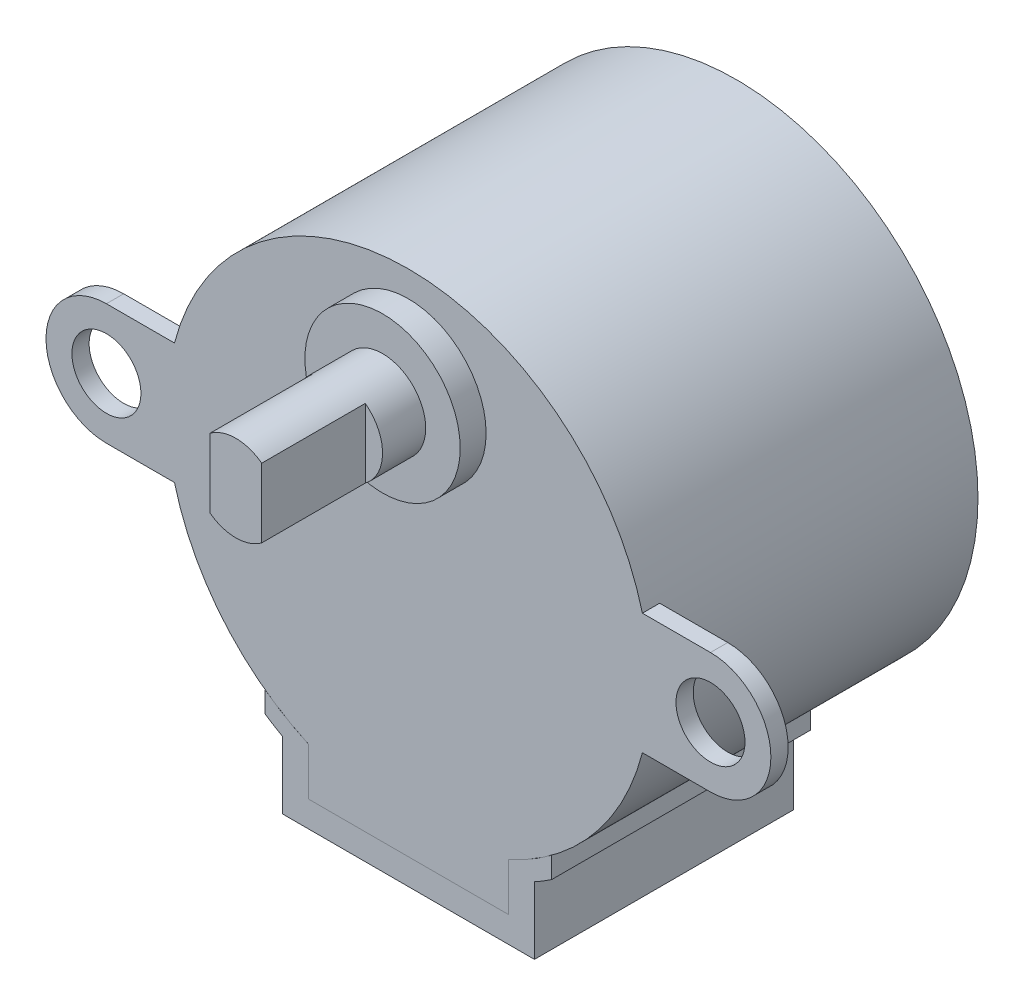
from build123d import *

# Parameters (mm, degrees)
SKETCH1_R           = 14
BOSS_EXTRUDE1_DEPTH = 19
SKETCH2_R           = 2
BOSS_EXTRUDE2_DEPTH = 1
SKETCH3_R           = 4.5
BOSS_EXTRUDE3_DEPTH = 1.5
SKETCH4_R           = 2.5
BOSS_EXTRUDE4_DEPTH = 8.5
CUT_EXTRUDE1_DEPTH  = 6
BOSS_EXTRUDE6_DEPTH = 15
BOSS_EXTRUDE7_DEPTH = 15
SKETCH10_W          = 6.5
SKETCH10_H          = 1.5
CUT_EXTRUDE2_DEPTH  = 1.5


with BuildPart() as part:
    # Sketch1 → Boss-Extrude1 (new body)
    with BuildSketch(Plane.XY):
        Circle(SKETCH1_R)
    extrude(amount=-BOSS_EXTRUDE1_DEPTH)

    # Sketch2 → Boss-Extrude2 (add)
    # profile 1 of 2: a face of its own
    with BuildSketch(Plane.XY):
        with BuildLine():
            Line((-13.555441712, 3.5), (-17.5, 3.5))
            ThreePointArc((-17.5, 3.5), (-21, 0), (-17.5, -3.5))
            Line((-17.5, -3.5), (-13.555441712, -3.5))
            ThreePointArc((-13.555441712, -3.5), (-14, 0), (-13.555441712, 3.5))
        make_face()
        with Locations((-17.5, 0)):
            Circle(SKETCH2_R, mode=Mode.SUBTRACT)
    # profile 2 of 2: a face of its own
    with BuildSketch(Plane.XY):
        with BuildLine():
            Line((17.5, 3.5), (13.555441712, 3.5))
            ThreePointArc((13.555441712, 3.5), (13.888415748, 1.764060095), (14, 0))
            ThreePointArc((14, 0), (13.888415748, -1.764060095), (13.555441712, -3.5))
            Line((13.555441712, -3.5), (17.5, -3.5))
            ThreePointArc((17.5, -3.5), (21, 0), (17.5, 3.5))
        make_face()
        with Locations((17.5, 0)):
            Circle(SKETCH2_R, mode=Mode.SUBTRACT)
    extrude(amount=-BOSS_EXTRUDE2_DEPTH)

    # Sketch3 → Boss-Extrude3 (add)
    with BuildSketch(Plane.XY):
        with Locations((0, 8)):
            Circle(SKETCH3_R)
    extrude(amount=BOSS_EXTRUDE3_DEPTH)

    # Sketch9 → Boss-Extrude7 (add)
    with BuildSketch(Plane.XY):
        with BuildLine():
            Line((5.8, -15.5), (5.8, -12.742056349))
            ThreePointArc((5.8, -12.742056349), (0, -14), (-5.8, -12.742056349))
            Line((-5.8, -12.742056349), (-5.8, -15.5))
            Line((-5.8, -15.5), (5.8, -15.5))
        make_face()
    extrude(amount=-BOSS_EXTRUDE7_DEPTH)


with BuildPart() as body_2:
    # Sketch4 → Boss-Extrude4 (new body)
    with BuildSketch(Plane.XY.offset(1.5)):
        with Locations((0, 8)):
            Circle(SKETCH4_R)
    extrude(amount=BOSS_EXTRUDE4_DEPTH)

    # Sketch5 → Cut-Extrude1 (cut)
    with BuildSketch(Plane.XY.offset(10)):
        with BuildLine():
            Line((-1.5, 6), (-1.5, 10))
            ThreePointArc((-1.5, 10), (-2.5, 8), (-1.5, 6))
        make_face()
        with BuildLine():
            ThreePointArc((2.5, 8), (2.236067977, 9.118033989), (1.5, 10))
            Line((1.5, 10), (1.5, 6))
            ThreePointArc((1.5, 6), (2.236067977, 6.881966011), (2.5, 8))
        make_face()
    extrude(amount=-CUT_EXTRUDE1_DEPTH, mode=Mode.SUBTRACT)


with BuildPart() as body_3:
    # Sketch6 → Boss-Extrude6 (new body)
    with BuildSketch(Plane.XY):
        with BuildLine():
            Line((-7.3, -13.103816238), (-7.3, -17))
            Line((-7.3, -17), (7.3, -17))
            Line((7.3, -17), (7.3, -13.103816238))
            ThreePointArc((7.3, -13.103816238), (7.805949489, -12.808870074), (8.3, -12.494398745))
            Line((8.3, -12.494398745), (8.3, -11.274307074))
            ThreePointArc((8.3, -11.274307074), (7.088093678, -12.073066223), (5.8, -12.742056349))
            Line((5.8, -12.742056349), (5.8, -15.5))
            Line((5.8, -15.5), (-5.8, -15.5))
            Line((-5.8, -15.5), (-5.8, -12.742056349))
            ThreePointArc((-5.8, -12.742056349), (-7.088093678, -12.073066223), (-8.3, -11.274307074))
            Line((-8.3, -11.274307074), (-8.3, -12.494398745))
            ThreePointArc((-8.3, -12.494398745), (-7.805949489, -12.808870074), (-7.3, -13.103816238))
        make_face()
    extrude(amount=-BOSS_EXTRUDE6_DEPTH)

    # Sketch10 → Cut-Extrude2 (cut)
    with BuildSketch(Plane(origin=(0, -17, 0), x_dir=(-1, 0, 0), z_dir=(0, -1, 0))):
        with Locations((0, 1.75)):
            Rectangle(SKETCH10_W, SKETCH10_H)
    extrude(amount=-CUT_EXTRUDE2_DEPTH, mode=Mode.SUBTRACT)


solid = Compound([part.part, body_2.part, body_3.part])
